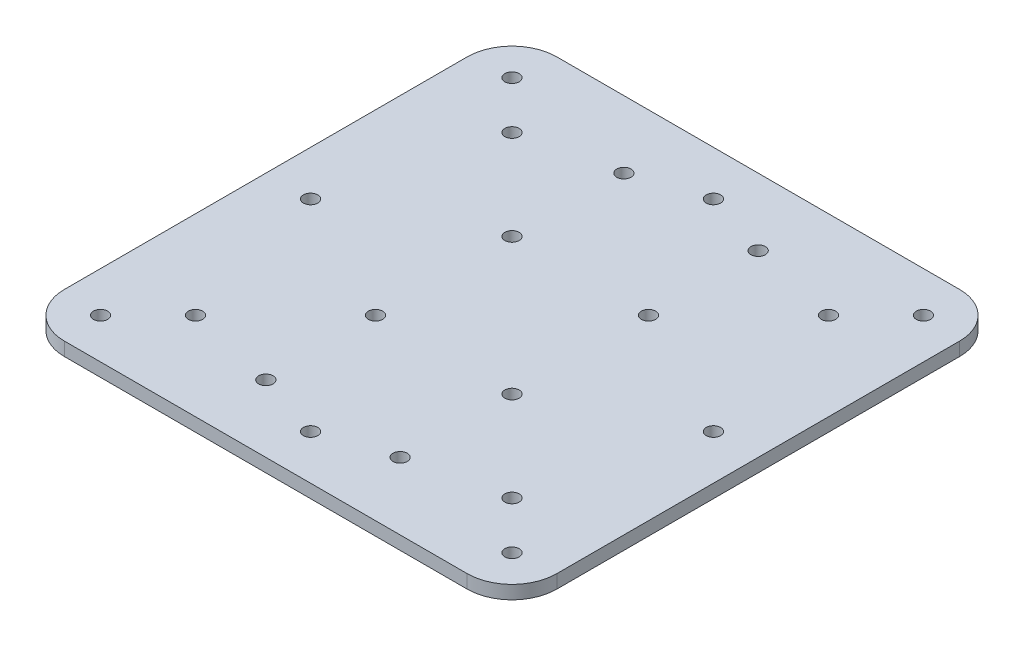
from build123d import *

# Parameters (mm, degrees)
SKETCH2_W           = 110
SKETCH2_H           = 110
SKETCH2_R           = 1.6
BOSS_EXTRUDE1_DEPTH = 3
FILLET1_R           = 10


with BuildPart() as part:
    # Sketch2 → Boss-Extrude1 (new body)
    with BuildSketch(Plane(origin=(0, 0, 0), x_dir=(1, 0, 0), z_dir=(0, 1, 0))):
        Rectangle(SKETCH2_W, SKETCH2_H)
        with Locations((15.25, 15.25)):
            Circle(SKETCH2_R, mode=Mode.SUBTRACT)
        with Locations((-15.25, 15.25)):
            Circle(SKETCH2_R, mode=Mode.SUBTRACT)
        with Locations((-15.25, -15.25)):
            Circle(SKETCH2_R, mode=Mode.SUBTRACT)
        with Locations((15.25, -15.25)):
            Circle(SKETCH2_R, mode=Mode.SUBTRACT)
        with Locations((35.3553, 35.3553)):
            Circle(SKETCH2_R, mode=Mode.SUBTRACT)
        with Locations((45.9619, 45.9619)):
            Circle(SKETCH2_R, mode=Mode.SUBTRACT)
        with Locations((-35.3553, 35.3553)):
            Circle(SKETCH2_R, mode=Mode.SUBTRACT)
        with Locations((-45.9619, 45.9619)):
            Circle(SKETCH2_R, mode=Mode.SUBTRACT)
        with Locations((45.9619, -45.9619)):
            Circle(SKETCH2_R, mode=Mode.SUBTRACT)
        with Locations((35.3553, -35.3553)):
            Circle(SKETCH2_R, mode=Mode.SUBTRACT)
        with Locations((-45.9619, -45.9619)):
            Circle(SKETCH2_R, mode=Mode.SUBTRACT)
        with Locations((-35.3553, -35.3553)):
            Circle(SKETCH2_R, mode=Mode.SUBTRACT)
        with Locations((0, 45)):
            Circle(SKETCH2_R, mode=Mode.SUBTRACT)
        with Locations((-45, 0)):
            Circle(SKETCH2_R, mode=Mode.SUBTRACT)
        with Locations((45, 0)):
            Circle(SKETCH2_R, mode=Mode.SUBTRACT)
        with Locations((0, -45)):
            Circle(SKETCH2_R, mode=Mode.SUBTRACT)
        with Locations((-15, -40)):
            Circle(SKETCH2_R, mode=Mode.SUBTRACT)
        with Locations((15, -40)):
            Circle(SKETCH2_R, mode=Mode.SUBTRACT)
        with Locations((-15, 40)):
            Circle(SKETCH2_R, mode=Mode.SUBTRACT)
        with Locations((15, 40)):
            Circle(SKETCH2_R, mode=Mode.SUBTRACT)
    extrude(amount=BOSS_EXTRUDE1_DEPTH)

    # Fillet1
    fillet1_edges = [part.edges().sort_by_distance(p)[0] for p in [
        (55, 1.5, 55),
        (55, 1.5, -55),
        (-55, 1.5, 55),
        (-55, 1.5, -55),
    ]]
    fillet(fillet1_edges, radius=FILLET1_R)


solid = part.part
